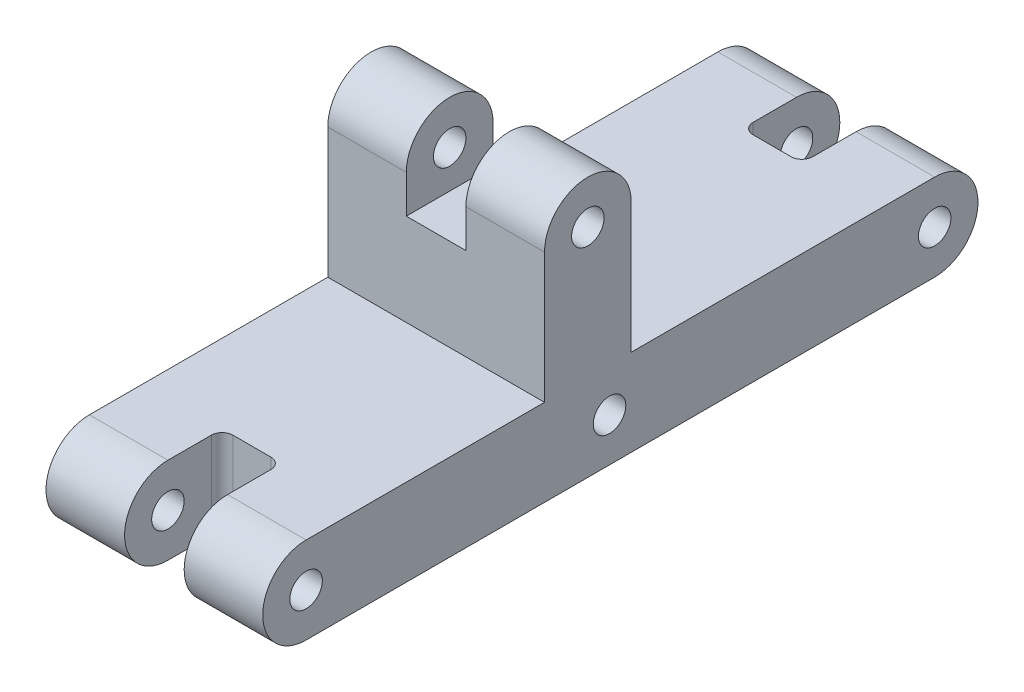
from build123d import *

# Parameters (mm, degrees)
CROQUIS1_R              = 1.5
SALIENTE_EXTRUIR1_DEPTH = 10
CROQUIS2_W              = 8
CROQUIS2_H              = 7.5
CROQUIS2_W_2            = 9
CROQUIS2_H_2            = 8
CORTAR_EXTRUIR1_DEPTH   = 2.75
REDONDEO1_R             = 1


with BuildPart() as part:
    # Croquis1 → Saliente-Extruir1 (new, symmetric)
    with BuildSketch(Plane(origin=(0, 0, 0), x_dir=(0, 0, -1), z_dir=(1, 0, 0))):
        with BuildLine():
            Line((-15, -4), (15, -4))
            ThreePointArc((15, -4), (19, 0), (15, 4))
            Line((15, 4), (-13, 4))
            Line((-13, 4), (-13, 16))
            ThreePointArc((-13, 16), (-17, 20), (-21, 16))
            Line((-21, 16), (-21, 4))
            Line((-21, 4), (-43, 4))
            ThreePointArc((-43, 4), (-47, 0), (-43, -4))
            Line((-43, -4), (-15, -4))
        make_face()
        with Locations((15, 0)):
            Circle(CROQUIS1_R, mode=Mode.SUBTRACT)
        with Locations((-17, 16)):
            Circle(CROQUIS1_R, mode=Mode.SUBTRACT)
        with Locations((-15, 0)):
            Circle(CROQUIS1_R, mode=Mode.SUBTRACT)
        with Locations((-43, 0)):
            Circle(CROQUIS1_R, mode=Mode.SUBTRACT)
    extrude(amount=SALIENTE_EXTRUIR1_DEPTH, both=True)

    # Croquis2 → Cortar-Extruir1 (cut, symmetric)
    with BuildSketch(Plane(origin=(0, 0, 0), x_dir=(0, 0, -1), z_dir=(1, 0, 0))):
        with Locations((-17, 16.25)):
            Rectangle(CROQUIS2_W, CROQUIS2_H)
        with Locations((14.5, 0)):
            Rectangle(CROQUIS2_W_2, CROQUIS2_H_2)
        with Locations((-42.5, 0)):
            Rectangle(CROQUIS2_W_2, CROQUIS2_H_2)
    extrude(amount=CORTAR_EXTRUIR1_DEPTH, both=True, mode=Mode.SUBTRACT)

    # Redondeo1
    redondeo1_edges = [part.edges().sort_by_distance(p)[0] for p in [
        (2.75, 0, 38),
        (-2.75, 0, 38),
        (2.75, 0, -10),
        (-2.75, 0, -10),
    ]]
    fillet(redondeo1_edges, radius=REDONDEO1_R)


solid = part.part
